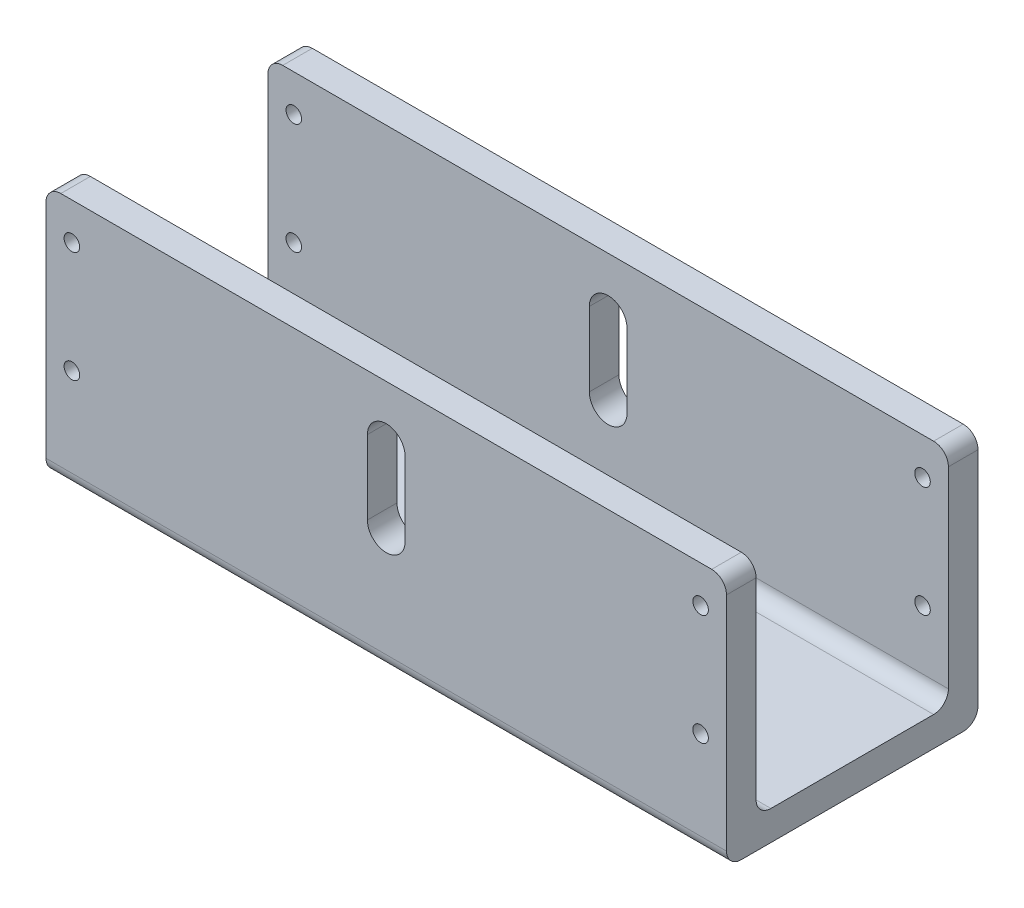
from build123d import *

# Parameters (mm, degrees)
SKETCH_1_W          = 92
SKETCH_1_H          = 30
SKETCH_1_R          = 1.05
EXTRUDE_1_DEPTH     = 4
SKETCH_4_W          = 92
SKETCH_4_H          = 30
EXTRUDE_4_DEPTH     = 4
SKETCH_5_W          = 92
SKETCH_5_H          = 34
SKETCH_5_R          = 1.05
EXTRUDE_5_DEPTH     = 4
FILLET_4_R          = 2
CUT_EXTRUDE_1_DEPTH = 45
SKETCH_8_R          = 2.55
CUT_EXTRUDE_2_DEPTH = 5


with BuildPart() as part:
    # 草图1 → 凸台-拉伸1 (new body)
    with BuildSketch(Plane.XY):
        with Locations((46, -15)):
            Rectangle(SKETCH_1_W, SKETCH_1_H)
        with Locations((3.5, -5)):
            Circle(SKETCH_1_R, mode=Mode.SUBTRACT)
        with Locations((3.5, -20)):
            Circle(SKETCH_1_R, mode=Mode.SUBTRACT)
        with Locations((88.5, -5)):
            Circle(SKETCH_1_R, mode=Mode.SUBTRACT)
        with Locations((88.5, -20)):
            Circle(SKETCH_1_R, mode=Mode.SUBTRACT)
        with BuildLine():
            Line((43.45, -17.5), (43.45, -7.5))
            ThreePointArc((43.45, -7.5), (46, -4.95), (48.55, -7.5))
            Line((48.55, -7.5), (48.55, -17.5))
            ThreePointArc((48.55, -17.5), (46, -20.05), (43.45, -17.5))
        make_face(mode=Mode.SUBTRACT)
    extrude(amount=EXTRUDE_1_DEPTH)

    # 草图4 → 凸台-拉伸4 (add)
    with BuildSketch(Plane(origin=(0, -30, 0), x_dir=(-1, 0, 0), z_dir=(0, -1, 0))):
        with Locations((-46, -15)):
            Rectangle(SKETCH_4_W, SKETCH_4_H)
    extrude(amount=EXTRUDE_4_DEPTH)

    # 草图5 → 凸台-拉伸5 (add)
    with BuildSketch(Plane.XY.offset(30)):
        with Locations((46, -17)):
            Rectangle(SKETCH_5_W, SKETCH_5_H)
        with Locations((3.5, -5)):
            Circle(SKETCH_5_R, mode=Mode.SUBTRACT)
        with Locations((3.5, -20)):
            Circle(SKETCH_5_R, mode=Mode.SUBTRACT)
        with Locations((88.5, -20)):
            Circle(SKETCH_5_R, mode=Mode.SUBTRACT)
        with Locations((88.5, -5)):
            Circle(SKETCH_5_R, mode=Mode.SUBTRACT)
    extrude(amount=EXTRUDE_5_DEPTH)

    # 圆角4
    fillet_4_edges = [part.edges().sort_by_distance(p)[0] for p in [
        (46, -30, 30),
        (46, -34, 0),
        (46, -34, 34),
        (0, 0, 32),
        (92, 0, 32),
        (0, 0, 2),
        (92, 0, 2),
        (46, -30, 4),
    ]]
    fillet(fillet_4_edges, radius=FILLET_4_R)

    # 草图7 → 切除-拉伸1 (cut)
    with BuildSketch(Plane(origin=(0, 0, 0), x_dir=(-1, 0, 0), z_dir=(0, 0, -1))):
        with BuildLine():
            Line((-48.55, -17.5), (-48.55, -7.5))
            ThreePointArc((-48.55, -7.5), (-46, -4.95), (-43.45, -7.5))
            Line((-43.45, -7.5), (-43.45, -17.5))
            ThreePointArc((-43.45, -17.5), (-46, -20.05), (-48.55, -17.5))
        make_face()
    extrude(amount=-CUT_EXTRUDE_1_DEPTH, mode=Mode.SUBTRACT)

    # 草图8 → 切除-拉伸2 (cut)
    with BuildSketch(Plane(origin=(0, -34, 0), x_dir=(-1, 0, 0), z_dir=(0, -1, 0))):
        with Locations(Location((-46, -16.5, 0), (0, 0, 90))):
            Circle(SKETCH_8_R)
    extrude(amount=-CUT_EXTRUDE_2_DEPTH, mode=Mode.SUBTRACT)


solid = part.part
